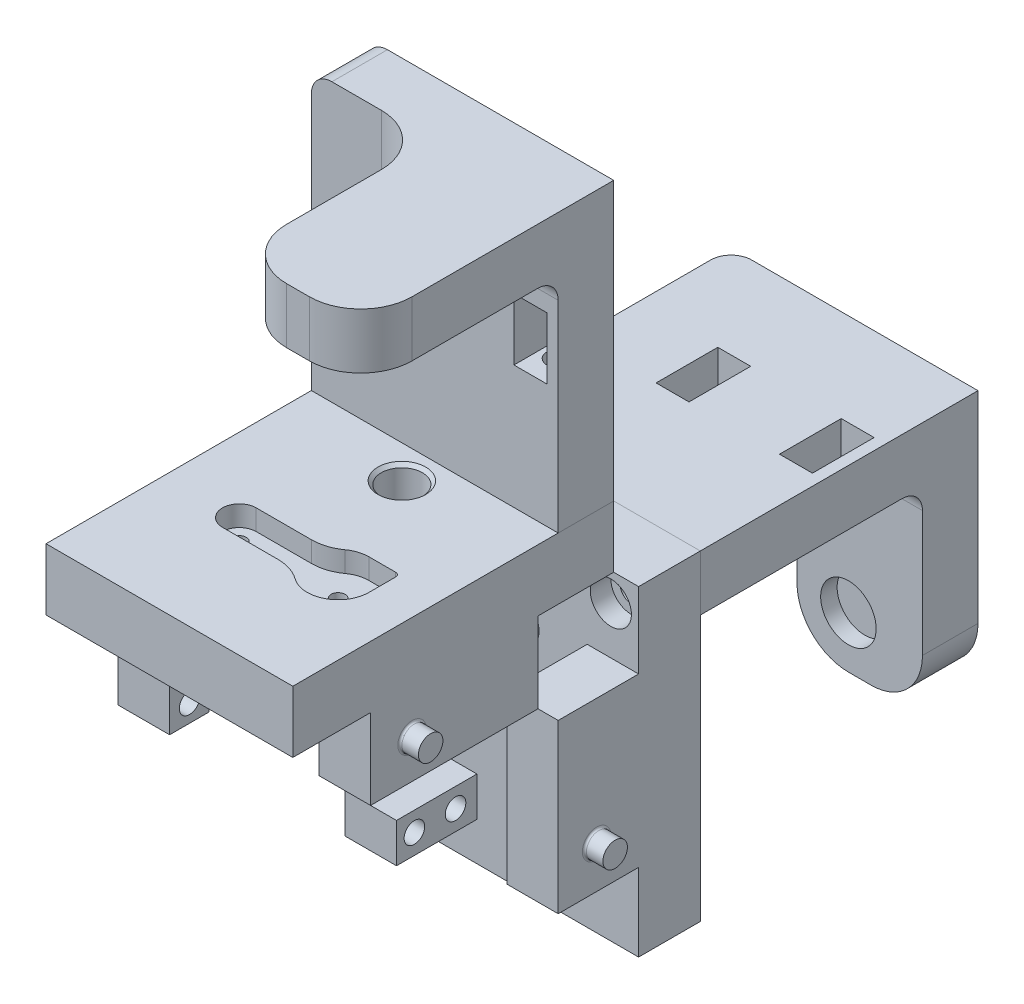
from build123d import *

# Parameters (mm, degrees)
BOSS_EXTRUDE1_DEPTH                              = 15
CUT_EXTRUDE2_DEPTH                               = 5
SKETCH12_W                                       = 12.5
SKETCH12_H                                       = 9.55
BOSS_EXTRUDE5_DEPTH                              = 19.55
SKETCH13_R                                       = 2.5
CUT_EXTRUDE3_DEPTH                               = 74.935394095
CBORE_FOR_M3_PAN_HEAD_MACHINE_SCREW1_D           = 3.4
CBORE_FOR_M3_PAN_HEAD_MACHINE_SCREW1_CBORE_D     = 7
CBORE_FOR_M3_PAN_HEAD_MACHINE_SCREW1_CBORE_DEPTH = 2.4
SKETCH14_W                                       = 60
SKETCH14_H                                       = 82.5
BOSS_EXTRUDE6_DEPTH                              = 13.5
SKETCH16_W                                       = 30.5
SKETCH16_H                                       = 48
BOSS_EXTRUDE7_DEPTH                              = 13.5
SKETCH17_R                                       = 6.746875
CUT_EXTRUDE4_DEPTH                               = 4
CHAMBRAGE_POUR_VIS_T_TE_CYLINDRIQUE_AT_COUNT     = 2
CHAMBRAGE_POUR_VIS_T_TE_CYLINDRIQUE_AT_PITCH     = 30
SKETCH22_W                                       = 12.5
SKETCH22_H                                       = 40.7
BOSS_EXTRUDE8_DEPTH                              = 19.55
SKETCH23_R                                       = 2.9765625
BOSS_EXTRUDE9_DEPTH                              = 4.5
FILLET2_R                                        = 0.5
ESQUISSE6_W                                      = 8
ESQUISSE6_H                                      = 15
ENL_V_MAT_EXTRU_4_DEPTH                          = 123.68863028
CONG_1_R                                         = 12.5
CONG_2_R                                         = 5
ESQUISSE7_R                                      = 5
ENL_V_MAT_EXTRU_5_DEPTH                          = 107.627857601
SPLIT3_SURFACE_1_BACK                            = 144.73
SPLIT3_SURFACE_1_DEPTH                           = 289.46
SPLIT3_SURFACE_2_BACK                            = 144.73
SPLIT3_SURFACE_2_DEPTH                           = 289.46
ESQUISSE4_R                                      = 5
ENL_V_MAT_EXTRU_2_DEPTH                          = 15
CHANFREIN1_SIZE                                  = 0.8


with BuildPart() as part:
    # Sketch1 → Boss-Extrude1 (new body)
    with BuildSketch(Plane(origin=(0, 0, 0), x_dir=(1, 0, 0), z_dir=(0, 1, 0))):
        Polygon((42, 29), (42, 49), (-18, 49), (-18, 29), (-18, -29), (42, -29), align=None)
    extrude(amount=BOSS_EXTRUDE1_DEPTH)

    # Sketch2 → Cut-Extrude2 (cut)
    with BuildSketch(Plane(origin=(0, 15, 0), x_dir=(1, 0, 0), z_dir=(0, 1, 0))):
        with BuildLine():
            Line((13.481173341, -4.1), (0, -4.1))
            ThreePointArc((0, -4.1), (-2.899137803, -2.899137803), (-4.1, 0))
            ThreePointArc((-4.1, 0), (-2.899137803, 2.899137803), (0, 4.1))
            Line((0, 4.1), (13.481173341, 4.1))
            ThreePointArc((13.481173341, 4.1), (16.701790443, 4.607571798), (19.610187602, 6.081081081))
            ThreePointArc((19.610187602, 6.081081081), (21.69328243, 7.13645949), (24, 7.5))
            Line((24, 7.5), (30.5, 7.5))
            ThreePointArc((30.5, 7.5), (31.207106781, 7.207106781), (31.5, 6.5))
            Line((31.5, 6.5), (31.5, 0))
            ThreePointArc((31.5, 0), (27.415143263, -6.677334535), (19.610187602, -6.081081081))
            ThreePointArc((19.610187602, -6.081081081), (16.701790443, -4.607571798), (13.481173341, -4.1))
        make_face()
    extrude(amount=-CUT_EXTRUDE2_DEPTH, mode=Mode.SUBTRACT)

    # Sketch11 → CBORE for M3 SHCS2 (revolve, cut)
    with BuildSketch(Plane(origin=(24, 0, 0), x_dir=(0, 0, -1), z_dir=(1, 0, 0))):
        Polygon((0, 0), (0, 15), (1.7, 15), (1.7, 3), (3.25, 3), (3.25, 0.025), (3.275, 0), align=None)
    revolve(axis=Axis((24, -6.35, 0), (0, 1, 0)), mode=Mode.SUBTRACT)

    # Sketch12 → Boss-Extrude5 (add)
    with BuildSketch(Plane.XZ):
        with Locations((-3.55, -35.375)):
            Rectangle(SKETCH12_W, SKETCH12_H)
        with Locations((-3.55, 14.875)):
            Rectangle(SKETCH12_W, SKETCH12_H)
    extrude(amount=BOSS_EXTRUDE5_DEPTH)

    # Sketch13 → Cut-Extrude3 (cut, through all)
    with BuildSketch(Plane.ZY.offset(9.8)):
        with Locations((14.8, -5.2)):
            Circle(SKETCH13_R)
        with Locations((14.8, -15.2)):
            Circle(SKETCH13_R)
        with Locations((-34.8, -5.2)):
            Circle(SKETCH13_R)
        with Locations((-34.8, -15.2)):
            Circle(SKETCH13_R)
    extrude(amount=-CUT_EXTRUDE3_DEPTH, mode=Mode.SUBTRACT)

    # CBORE for M3 Pan Head Machine Screw1 (through all)
    with Locations(Plane(origin=(0, 0, 0), x_dir=(0, 0, -1), z_dir=(0, -1, 0))):
        with Locations((0, 0)):
            CounterBoreHole(CBORE_FOR_M3_PAN_HEAD_MACHINE_SCREW1_D / 2, CBORE_FOR_M3_PAN_HEAD_MACHINE_SCREW1_CBORE_D / 2, CBORE_FOR_M3_PAN_HEAD_MACHINE_SCREW1_CBORE_DEPTH)

    # Sketch14 → Boss-Extrude6 (add)
    with BuildSketch(Plane(origin=(0, 49, -49), x_dir=(1, 0, 0), z_dir=(0, 0, 1))):
        with Locations((12, -7.75)):
            Rectangle(SKETCH14_W, SKETCH14_H)
    extrude(amount=BOSS_EXTRUDE6_DEPTH)

    # Sketch16 → Boss-Extrude7 (add)
    with BuildSketch(Plane(origin=(0, 82.5, -132), x_dir=(1, 0, 0), z_dir=(0, -1, 0))):
        with Locations((26.75, 120.5)):
            Rectangle(SKETCH16_W, SKETCH16_H)
    extrude(amount=BOSS_EXTRUDE7_DEPTH)

    # Sketch17 → Cut-Extrude4 (cut)
    with BuildSketch(Plane(origin=(0, 69, -77), x_dir=(1, 0, 0), z_dir=(0, -1, 0))):
        with Locations((24, 77)):
            Circle(SKETCH17_R)
    extrude(amount=-CUT_EXTRUDE4_DEPTH, mode=Mode.SUBTRACT)

    # Sketch20 → Chambrage pour vis à tête cylindrique à 6 pans creux (ou vis CHC) M51 (revolve, cut)
    with BuildSketch(Plane(origin=(35.25, 0, -42.25), x_dir=(0, 0, -1), z_dir=(1, 0, 0))):
        Polygon((0, 0), (0, 46.652366702), (2.75, 45), (2.75, 5), (5, 5), (5, 0), align=None)
    chambrage_pour_vis_t_te_cylindrique = revolve(axis=Axis((35.25, -6.35, -42.25), (0, 1, 0)), mode=Mode.SUBTRACT)

    # Chambrage pour vis à tête cylindrique à 6 pans creux (ou vis CHC) M51 at: Chambrage pour vis à tête cylindrique à 6 pans creux (ou vis CHC) M51 ×2
    with Locations(*[(-i * CHAMBRAGE_POUR_VIS_T_TE_CYLINDRIQUE_AT_PITCH, 0, 0) for i in range(1, CHAMBRAGE_POUR_VIS_T_TE_CYLINDRIQUE_AT_COUNT)]):
        add(chambrage_pour_vis_t_te_cylindrique, mode=Mode.SUBTRACT)

    # Sketch22 → Boss-Extrude8 (add)
    with BuildSketch(Plane.XZ):
        with Locations((35.75, -10.25)):
            Rectangle(SKETCH22_W, SKETCH22_H)
    extrude(amount=BOSS_EXTRUDE8_DEPTH)

    # Sketch23 → Boss-Extrude9 (add)
    with BuildSketch(Plane(origin=(42, 0, 0), x_dir=(0, 0, -1), z_dir=(1, 0, 0))):
        with Locations(Location((0, -10.2, 0), (0, 0, 180))):
            Circle(SKETCH23_R)
    extrude(amount=BOSS_EXTRUDE9_DEPTH)

    # Fillet2
    fillet2_edges = [part.edges().sort_by_distance(p)[0] for p in [
        (42, -10.2, -2.9765625),
    ]]
    fillet(fillet2_edges, radius=FILLET2_R)

    # Esquisse6 → Enlèv. mat.-Extru.4 (cut, through all)
    with BuildSketch(Plane.XY.offset(-49)):
        with Locations((35.25, 52.5)):
            Rectangle(ESQUISSE6_W, ESQUISSE6_H)
        with Locations((5.25, 52.5)):
            Rectangle(ESQUISSE6_W, ESQUISSE6_H)
    extrude(amount=ENL_V_MAT_EXTRU_4_DEPTH, mode=Mode.SUBTRACT)

    # Congé1
    cong_1_edges = [part.edges().sort_by_distance(p)[0] for p in [
        (11.5, 75.75, 12.5),
        (11.5, 75.75, -35.5),
        (42, 75.75, 12.5),
    ]]
    fillet(cong_1_edges, radius=CONG_1_R)

    # Congé2
    cong_2_edges = [part.edges().sort_by_distance(p)[0] for p in [
        (-18, 82.5, -42.25),
        (20.5, 69, -35.5),
    ]]
    fillet(cong_2_edges, radius=CONG_2_R)

    # Esquisse7 → Enlèv. mat.-Extru.5 (cut, through all)
    with BuildSketch(Plane.XZ):
        with Locations(Location((5.25, -42.25, 0), (0, 0, 270))):
            Circle(ESQUISSE7_R)
    extrude(amount=ENL_V_MAT_EXTRU_5_DEPTH, mode=Mode.SUBTRACT)


with BuildPart() as body_2:
    # Split3: the piece behind the surface
    add(part.part)
    # Split3 surface: a surface, the sketch's curves swept straight by 289.46 mm
    with BuildLine(Plane(origin=(42, 0, 0), x_dir=(0, 0, -1), z_dir=(1, 0, 0)).offset(-SPLIT3_SURFACE_1_BACK), mode=Mode.PRIVATE) as split3_surface_1_path:
        Line((49, 15), (35.5, 15))
    split3_surface_1 = Shell.extrude(split3_surface_1_path.wire(), (1 * SPLIT3_SURFACE_1_DEPTH, 0 * SPLIT3_SURFACE_1_DEPTH, 0 * SPLIT3_SURFACE_1_DEPTH))
    split(bisect_by=split3_surface_1, keep=Keep.BOTTOM)


with BuildPart() as part_1:
    add(part.part)

    # Split3: split by a surface, the side it looks to stays
    # Split3 surface: a surface, the sketch's curves swept straight by 289.46 mm
    with BuildLine(Plane(origin=(42, 0, 0), x_dir=(0, 0, -1), z_dir=(1, 0, 0)).offset(-SPLIT3_SURFACE_2_BACK), mode=Mode.PRIVATE) as split3_surface_2_path:
        Line((49, 15), (35.5, 15))
    split3_surface_2 = Shell.extrude(split3_surface_2_path.wire(), (1 * SPLIT3_SURFACE_2_DEPTH, 0 * SPLIT3_SURFACE_2_DEPTH, 0 * SPLIT3_SURFACE_2_DEPTH))
    split(bisect_by=split3_surface_2, keep=Keep.TOP)

    # Esquisse4 → Enlèv. mat.-Extru.2 (cut)
    with BuildSketch(Plane(origin=(0, 15, 0), x_dir=(1, 0, 0), z_dir=(0, 1, 0))):
        with Locations(Location((12, 27.5, 0), (0, 0, 270))):
            Circle(ESQUISSE4_R)
    extrude(amount=-ENL_V_MAT_EXTRU_2_DEPTH, mode=Mode.SUBTRACT)

    # Chanfrein1
    chanfrein1_edges = [part_1.edges().sort_by_distance(p)[0] for p in [
        (12, 15, -32.5),
        (12, 0, -32.5),
    ]]
    chamfer(chanfrein1_edges, length=CHANFREIN1_SIZE)


with BuildPart() as body_3:
    # Symétrie1: mirrored copy
    add(part_1.part.mirror(Plane(origin=(0, -27.525, -27.525), x_dir=(0, -0.7071067811865477, 0.7071067811865474), z_dir=(0, -0.7071067811865476, -0.7071067811865476))))


with BuildPart() as body_4:
    # Sym_trie1 2: mirrored copy
    add(body_2.part.mirror(Plane(origin=(0, -27.525, -27.525), x_dir=(0, -0.7071067811865477, 0.7071067811865474), z_dir=(0, -0.7071067811865476, -0.7071067811865476))))


solid = Compound([body_2.part, part_1.part, body_3.part, body_4.part])
